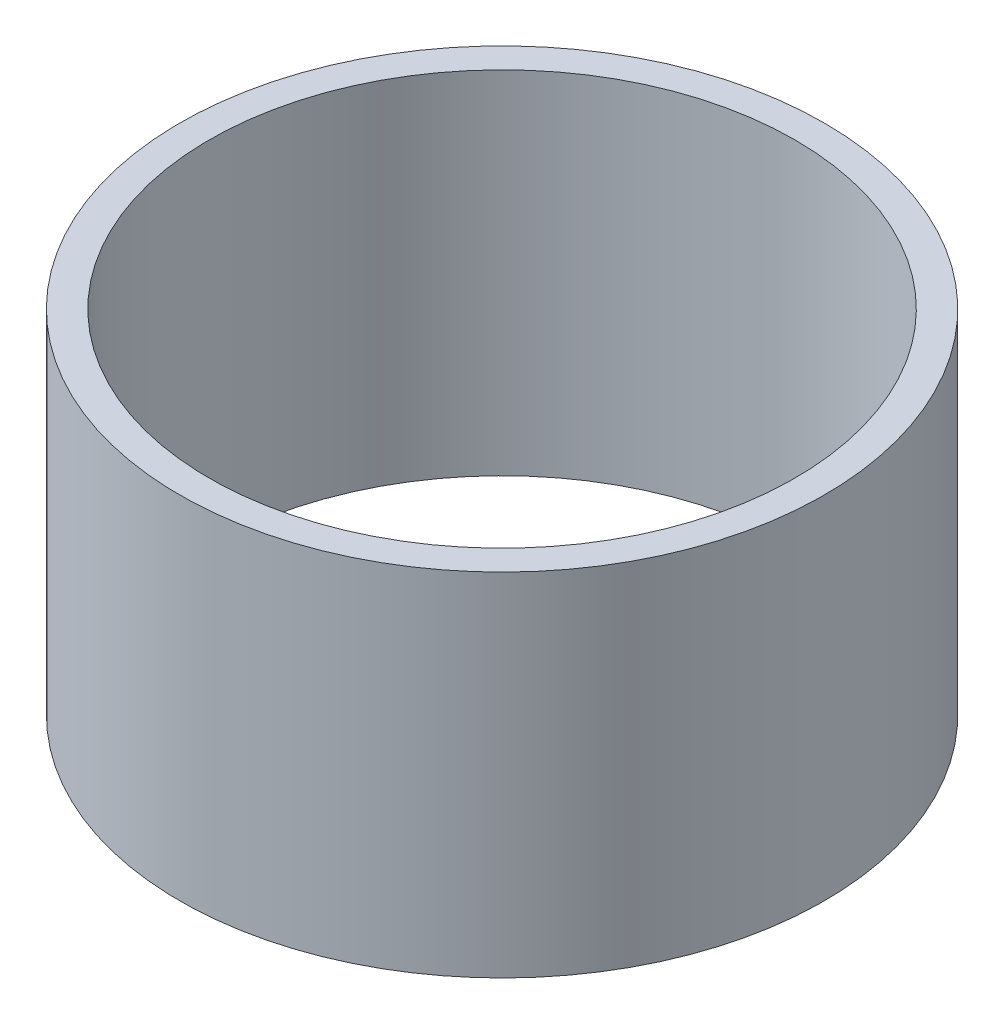
from build123d import *

# Parameters (mm, degrees)
SKETCH1_R           = 34.925
SKETCH1_R_2         = 31.75
BOSS_EXTRUDE1_DEPTH = 38.1


with BuildPart() as part:
    # Sketch1 → Boss-Extrude1 (new body)
    with BuildSketch(Plane(origin=(0, 0, 0), x_dir=(1, 0, 0), z_dir=(0, 1, 0))):
        with Locations(Location((0, 0, 0), (0, 0, 90))):
            Circle(SKETCH1_R)
        with Locations(Location((0, 0, 0), (0, 0, 90))):
            Circle(SKETCH1_R_2, mode=Mode.SUBTRACT)
    extrude(amount=BOSS_EXTRUDE1_DEPTH)


solid = part.part
